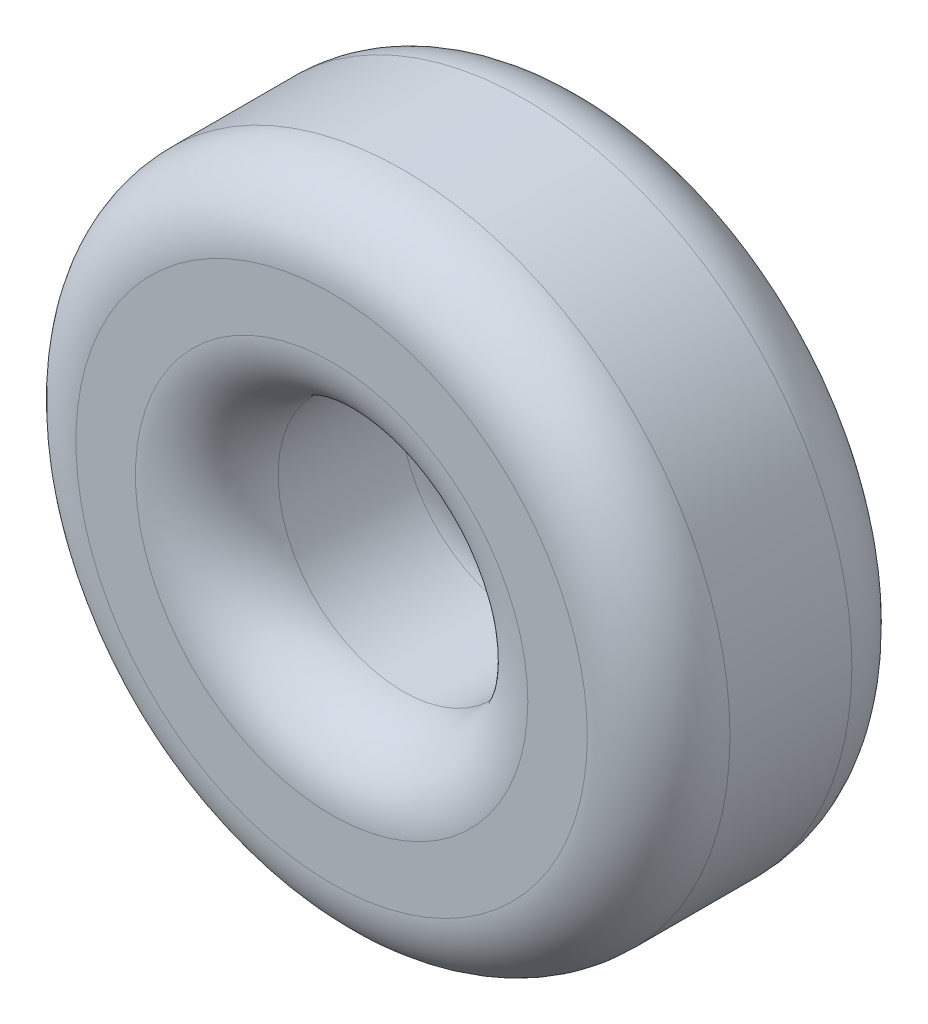
from build123d import *

# Parameters (mm, degrees)
SKETCH2_R           = 55
SKETCH2_R_2         = 21
BOSS_EXTRUDE1_DEPTH = 44.5
FILLET1_R           = 12


with BuildPart() as part:
    # Sketch2 → Boss-Extrude1 (new body)
    with BuildSketch(Plane.XY):
        with Locations((-9.780925239, 3.803880586)):
            Circle(SKETCH2_R)
        with Locations((-9.780925239, 3.803880586)):
            Circle(SKETCH2_R_2, mode=Mode.SUBTRACT)
    extrude(amount=BOSS_EXTRUDE1_DEPTH)

    # Fillet1
    fillet1_edges = [part.edges().sort_by_distance(p)[0] for p in [
        (-64.780925239, 3.803880586, 0),
        (-64.780925239, 3.803880586, 44.5),
        (-30.780925239, 3.803880586, 0),
        (-30.780925239, 3.803880586, 44.5),
    ]]
    fillet(fillet1_edges, radius=FILLET1_R)


solid = part.part
